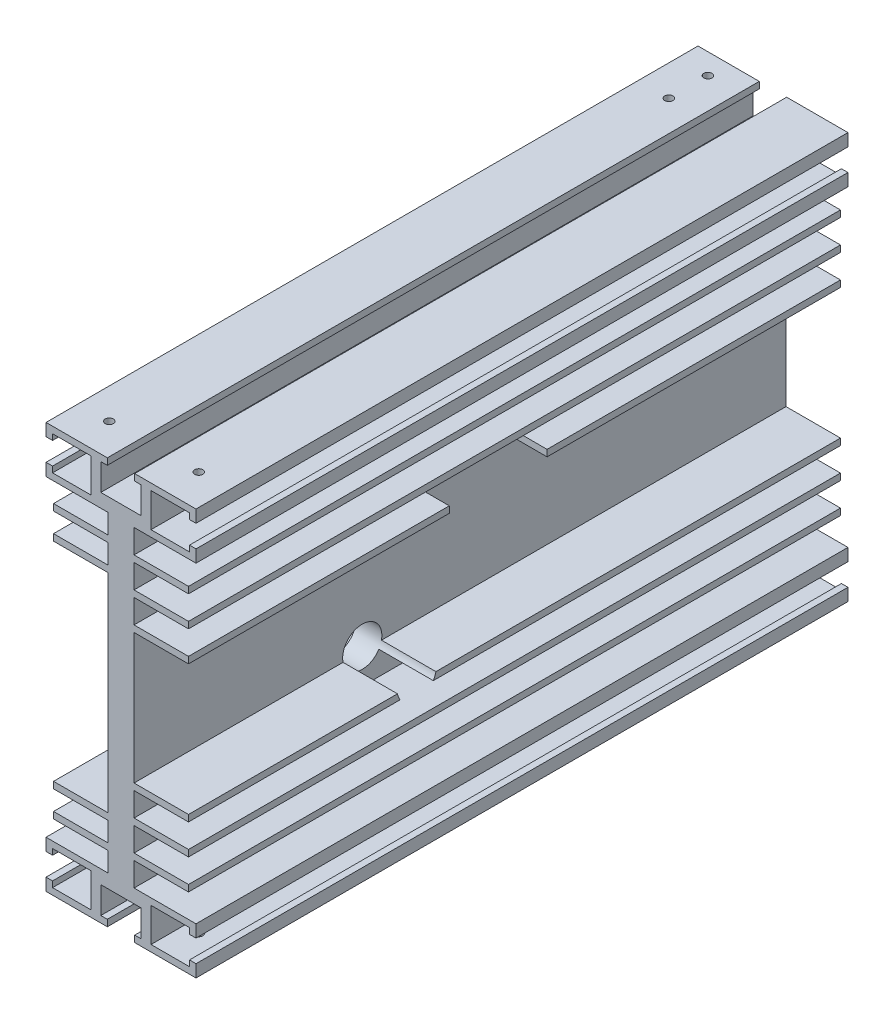
from build123d import *

# Parameters (mm, degrees)
RESSALTO_EXTRUS_O1_DEPTH                     = 200
CORTE_EXTRUS_O3_REACH                        = 224.463
ESBO_O4_R                                    = 1.825
CORTE_EXTRUS_O5_REACH                        = 224.463
ESBO_O6_R                                    = 6.0125
BROCA_DE_ROSQUEAR_PARA_TARRAXA_DE_M3X0_5_D   = 2.5
BROCA_DE_ROSQUEAR_PARA_TARRAXA_DE_M3_2_D     = 2.5
BROCA_DE_ROSQUEAR_PARA_TARRAXA_DE_M3_2_DEPTH = 8
BROCA_DE_ROSQUEAR_PARA_TARRAXA_DE_M3_3_D     = 2.5
BROCA_DE_ROSQUEAR_PARA_TARRAXA_DE_M3_3_DEPTH = 2
BROCA_DE_ROSQUEAR_PARA_TARRAXA_DE_M3_4_D     = 2.5
BROCA_DE_ROSQUEAR_PARA_TARRAXA_DE_M3_4_DEPTH = 2
BROCA_DE_ROSQUEAR_PARA_TARRAXA_DE_M3_5_D     = 2.5
BROCA_DE_ROSQUEAR_PARA_TARRAXA_DE_M3_5_DEPTH = 2
CORTE_EXTRUS_O6_START                        = -16.7
ESBO_O26_W                                   = 30
ESBO_O26_H                                   = 2
CORTE_EXTRUS_O6_DEPTH                        = 16.7
BROCA_DE_ROSQUEAR_PARA_TARRAXA_DE_M3_6_D     = 2.5
BROCA_DE_ROSQUEAR_PARA_TARRAXA_DE_M3_6_DEPTH = 2


with BuildPart() as part:
    # Esboço1 → Ressalto-extrusão1 (new body)
    with BuildSketch(Plane.XY):
        Polygon((-54.740307174, -0.6), (-54.740307174, 63.2), (-71.440307174, 63.2), (-71.440307174, 65.2), (-54.740307174, 65.2), (-54.740307174, 71.2), (-71.440307174, 71.2), (-71.440307174, 73.2), (-54.740307174, 73.2), (-54.740307174, 79.2), (-73.740307174, 79.2), (-73.740307174, 83), (-71.740307174, 83), (-71.740307174, 81.2), (-59.940307174, 81.2), (-59.940307174, 91.6), (-71.740307174, 91.6), (-71.740307174, 89.8), (-73.740307174, 89.8), (-73.740307174, 93.6), (-54.940307174, 93.6), (-54.940307174, 91.6), (-56.940307174, 91.6), (-56.940307174, 83.4), (-44.540307174, 83.4), (-44.540307174, 91.6), (-46.540307174, 91.6), (-46.540307174, 93.6), (-27.740307174, 93.6), (-27.740307174, 89.8), (-29.740307174, 89.8), (-29.740307174, 91.6), (-41.540307174, 91.6), (-41.540307174, 81.2), (-29.740307174, 81.2), (-29.740307174, 83), (-27.740307174, 83), (-27.740307174, 79.2), (-46.740307174, 79.2), (-46.740307174, 71.9), (-30.040307174, 71.9), (-30.040307174, 69.9), (-46.740307174, 69.9), (-46.740307174, 62.6), (-30.040307174, 62.6), (-30.040307174, 60.6), (-46.740307174, 60.6), (-46.740307174, 53.3), (-30.040307174, 53.3), (-30.040307174, 51.3), (-46.740307174, 51.3), (-46.740307174, 11.3), (-30.040307174, 11.3), (-30.040307174, 9.3), (-46.740307174, 9.3), (-46.740307174, 2), (-30.040307174, 2), (-30.040307174, 0), (-46.740307174, 0), (-46.740307174, -7.3), (-30.040307174, -7.3), (-30.040307174, -9.3), (-46.740307174, -9.3), (-46.740307174, -16.6), (-27.740307174, -16.6), (-27.740307174, -20.4), (-29.740307174, -20.4), (-29.740307174, -18.6), (-41.540307174, -18.6), (-41.540307174, -29), (-29.740307174, -29), (-29.740307174, -27.2), (-27.740307174, -27.2), (-27.740307174, -31), (-46.540307174, -31), (-46.540307174, -29), (-44.540307174, -29), (-44.540307174, -20.8), (-56.940307174, -20.8), (-56.940307174, -29), (-54.940307174, -29), (-54.940307174, -31), (-73.740307174, -31), (-73.740307174, -27.2), (-71.740307174, -27.2), (-71.740307174, -29), (-59.940307174, -29), (-59.940307174, -18.6), (-71.740307174, -18.6), (-71.740307174, -20.4), (-73.740307174, -20.4), (-73.740307174, -16.6), (-54.740307174, -16.6), (-54.740307174, -10.6), (-71.440307174, -10.6), (-71.440307174, -8.6), (-54.740307174, -8.6), (-54.740307174, -2.6), (-71.440307174, -2.6), (-71.440307174, -0.6), align=None)
    extrude(amount=RESSALTO_EXTRUS_O1_DEPTH)

    # Esboço4 → Corte-extrusão3 (cut, up to next)
    with BuildSketch(Plane.ZY.offset(54.740307174), mode=Mode.PRIVATE) as corte_extrus_o3_sk1:
        with Locations(Location((104, 50.1, 0), (0, 0, 270))):
            Circle(ESBO_O4_R)
    corte_extrus_o3_tool1 = extrude(corte_extrus_o3_sk1.sketch, amount=-CORTE_EXTRUS_O3_REACH, mode=Mode.PRIVATE) & part.part
    add(corte_extrus_o3_tool1.solids().sort_by_distance((-54.740307, 50.1, 104))[0], mode=Mode.SUBTRACT)

    # Esboço6 → Corte-extrusão5 (cut, up to next)
    with BuildSketch(Plane.ZY.offset(54.740307174), mode=Mode.PRIVATE) as corte_extrus_o5_sk1:
        with Locations(Location((130, 12.5, 0), (0, 0, 270))):
            Circle(ESBO_O6_R)
    corte_extrus_o5_tool1 = extrude(corte_extrus_o5_sk1.sketch, amount=-CORTE_EXTRUS_O5_REACH, mode=Mode.PRIVATE) & part.part
    add(corte_extrus_o5_tool1.solids().sort_by_distance((-54.740307, 12.5, 130))[0], mode=Mode.SUBTRACT)

    # Broca de rosquear para tarraxa de M3x0.5 (through all)
    with Locations(Plane.ZY.offset(54.740307174)):
        with Locations((6, 5.9), (6, 58.2)):
            Hole(BROCA_DE_ROSQUEAR_PARA_TARRAXA_DE_M3X0_5_D / 2)

    # Broca de rosquear para tarraxa de M3 2
    with Locations(Plane.ZY.offset(54.740307174)):
        with Locations((96, 50.1)):
            Hole(BROCA_DE_ROSQUEAR_PARA_TARRAXA_DE_M3_2_D / 2, depth=BROCA_DE_ROSQUEAR_PARA_TARRAXA_DE_M3_2_DEPTH)

    # Broca de rosquear para tarraxa de M3 3
    with Locations(Plane(origin=(0, 93.6, 0), x_dir=(-1, 0, 0), z_dir=(0, 1, 0))):
        with Locations((64.340307174, 190), (37.140307174, 189.76)):
            Hole(BROCA_DE_ROSQUEAR_PARA_TARRAXA_DE_M3_3_D / 2, depth=BROCA_DE_ROSQUEAR_PARA_TARRAXA_DE_M3_3_DEPTH)

    # Broca de rosquear para tarraxa de M3 4
    with Locations(Plane(origin=(0, 93.6, 0), x_dir=(-1, 0, 0), z_dir=(0, 1, 0))):
        with Locations((64.340307174, 18.36), (64.340307174, 6.36)):
            Hole(BROCA_DE_ROSQUEAR_PARA_TARRAXA_DE_M3_4_D / 2, depth=BROCA_DE_ROSQUEAR_PARA_TARRAXA_DE_M3_4_DEPTH)

    # Broca de rosquear para tarraxa de M3 5
    with Locations(Plane.XZ.offset(31)):
        with Locations((-64.340307174, 18.36), (-64.340307174, 6.36)):
            Hole(BROCA_DE_ROSQUEAR_PARA_TARRAXA_DE_M3_5_D / 2, depth=BROCA_DE_ROSQUEAR_PARA_TARRAXA_DE_M3_5_DEPTH)

    # Esboço26 → Corte-extrusão6 (cut)
    with BuildSketch(Plane(origin=(-30.040307174, 0, 0), x_dir=(0, 0, -1), z_dir=(1, 0, 0)).offset(CORTE_EXTRUS_O6_START)):
        with Locations((-105, 52.3)):
            Rectangle(ESBO_O26_W, ESBO_O26_H)
    extrude(amount=CORTE_EXTRUS_O6_DEPTH, mode=Mode.SUBTRACT)

    # Broca de rosquear para tarraxa de M3 6
    with Locations(Plane.XZ.offset(31)):
        with Locations((-64.340307174, 189.76), (-37.140307174, 189.76)):
            Hole(BROCA_DE_ROSQUEAR_PARA_TARRAXA_DE_M3_6_D / 2, depth=BROCA_DE_ROSQUEAR_PARA_TARRAXA_DE_M3_6_DEPTH)


solid = part.part
